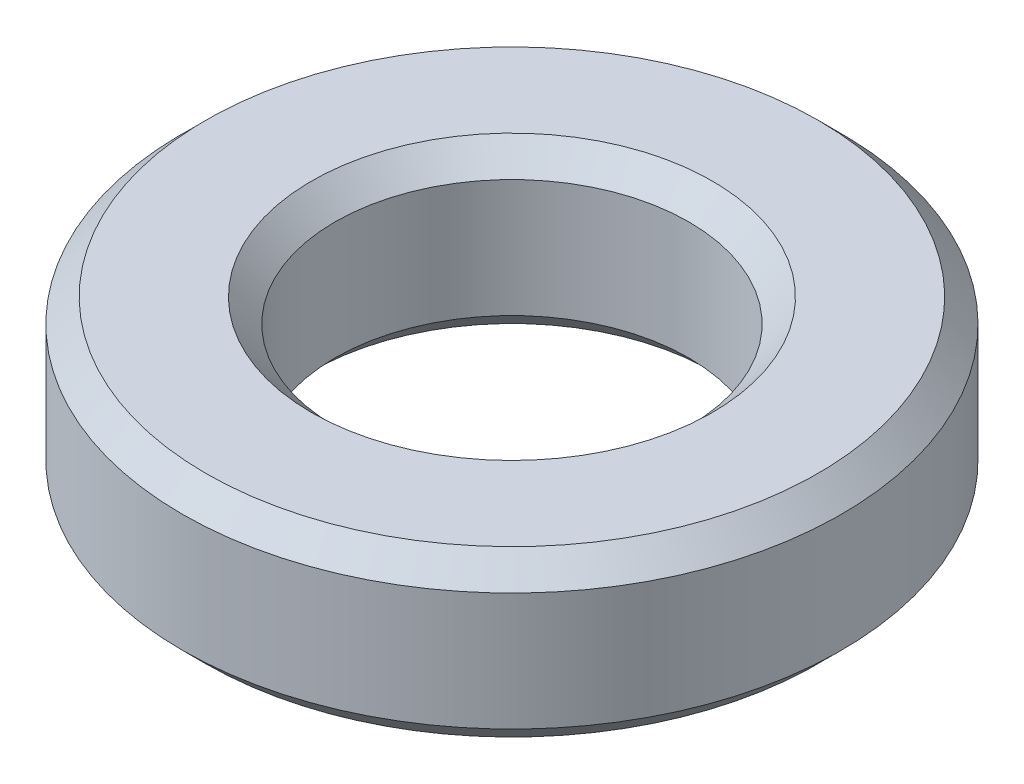
from build123d import *

# Parameters (mm, degrees)
SKETCH_1_R      = 13.99
SKETCH_1_R_2    = 7.51
EXTRUDE_1_DEPTH = 7
CHAMFER_1_SIZE  = 1


with BuildPart() as part:
    # 草图1 → 凸台-拉伸1 (new body)
    with BuildSketch(Plane(origin=(0, 0, 0), x_dir=(1, 0, 0), z_dir=(0, 1, 0))):
        with Locations(Location((0, 0, 0), (0, 0, 270))):
            Circle(SKETCH_1_R)
        with Locations(Location((0, 0, 0), (0, 0, 270))):
            Circle(SKETCH_1_R_2, mode=Mode.SUBTRACT)
    extrude(amount=EXTRUDE_1_DEPTH)

    # 倒角1
    chamfer_1_edges = [part.edges().sort_by_distance(p)[0] for p in [
        (0, 0, -13.99),
        (0, 7, -13.99),
        (0, 0, -7.51),
        (0, 7, -7.51),
    ]]
    chamfer(chamfer_1_edges, length=CHAMFER_1_SIZE)


solid = part.part
